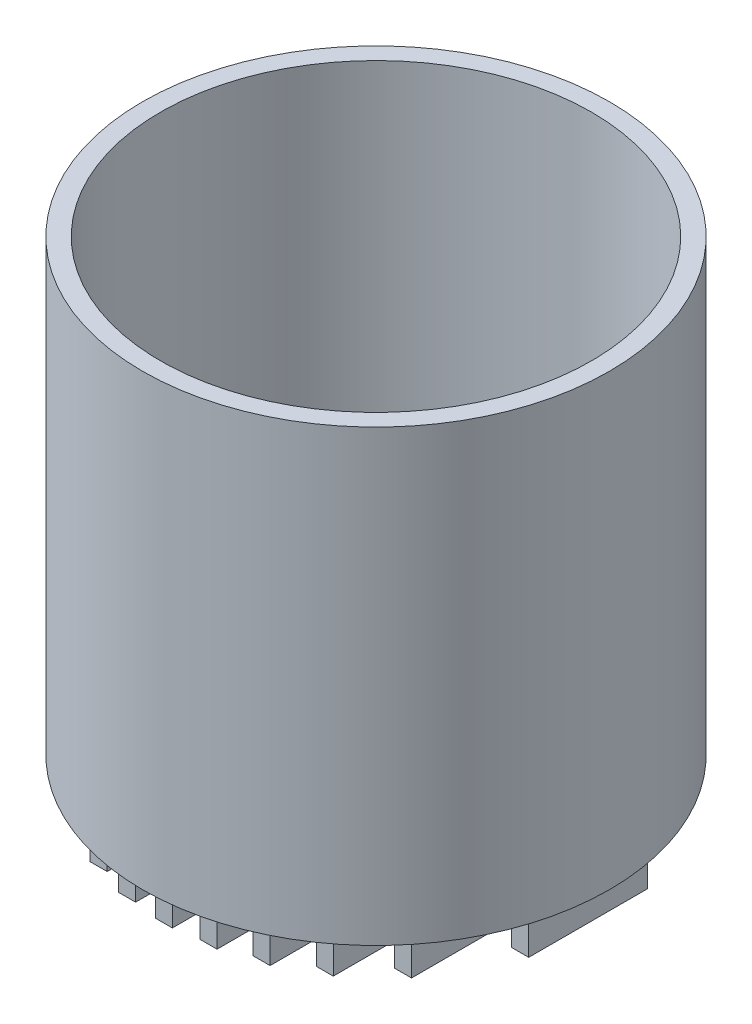
from build123d import *

# Parameters (mm, degrees)
SKETCH1_R           = 38.1
BOSS_EXTRUDE1_DEPTH = 76.2
SHELL2_T            = 3.175
SKETCH2_W           = 3
SKETCH2_H           = 75
SKETCH2_H_2         = 48.033738144
SKETCH2_H_3         = 61.308726948
SKETCH2_H_4         = 69.24998195
SKETCH2_H_5         = 73.60461942
BOSS_EXTRUDE2_DEPTH = 7
SCALE1_SCALE        = 0.615384615


with BuildPart() as part:
    # Sketch1 → Boss-Extrude1 (new body)
    with BuildSketch(Plane(origin=(0, 0, 0), x_dir=(1, 0, 0), z_dir=(0, 1, 0))):
        with Locations(Location((0, 0, 0), (0, 0, 90))):
            Circle(SKETCH1_R)
    extrude(amount=BOSS_EXTRUDE1_DEPTH)

    # Shell2
    shell2_openings = [part.faces().sort_by_distance(p)[0] for p in [
        (0, 76.2, 0),
    ]]
    offset(amount=SHELL2_T, openings=shell2_openings, kind=Kind.INTERSECTION)

    # Sketch2 → Boss-Extrude2 (add)
    with BuildSketch(Plane.XZ.offset(3.175)):
        Rectangle(SKETCH2_W, SKETCH2_H)
        Polygon((-34.5, -10.5), (-34.5, 0), (-34.5, 10.5), (-37.5, 10.5), (-37.5, -10.5), align=None)
        with Locations((-28.8, 0)):
            Rectangle(SKETCH2_W, SKETCH2_H_2)
        with Locations((-21.6, 0)):
            Rectangle(SKETCH2_W, SKETCH2_H_3)
        with Locations((-14.4, 0)):
            Rectangle(SKETCH2_W, SKETCH2_H_4)
        with Locations((-7.2, 0)):
            Rectangle(SKETCH2_W, SKETCH2_H_5)
        Polygon((8.7, -36.80230971), (8.7, 0), (8.7, 36.80230971), (5.7, 36.80230971), (5.7, -36.80230971), align=None)
        with Locations((14.4, 0)):
            Rectangle(SKETCH2_W, SKETCH2_H_4)
        with Locations((21.6, 0)):
            Rectangle(SKETCH2_W, SKETCH2_H_3)
        with Locations((28.8, 0)):
            Rectangle(SKETCH2_W, SKETCH2_H_2)
        Polygon((37.5, -10.5), (37.5, 10.5), (34.5, 10.5), (34.5, 0), (34.5, -10.5), align=None)
    extrude(amount=BOSS_EXTRUDE2_DEPTH)


with BuildPart() as part_1:
    # Scale1: scaled about (0, 24.172158943, 0)
    add(part.part.scale(SCALE1_SCALE).moved(Location((0, 9.296984209, 0))))


solid = part_1.part
